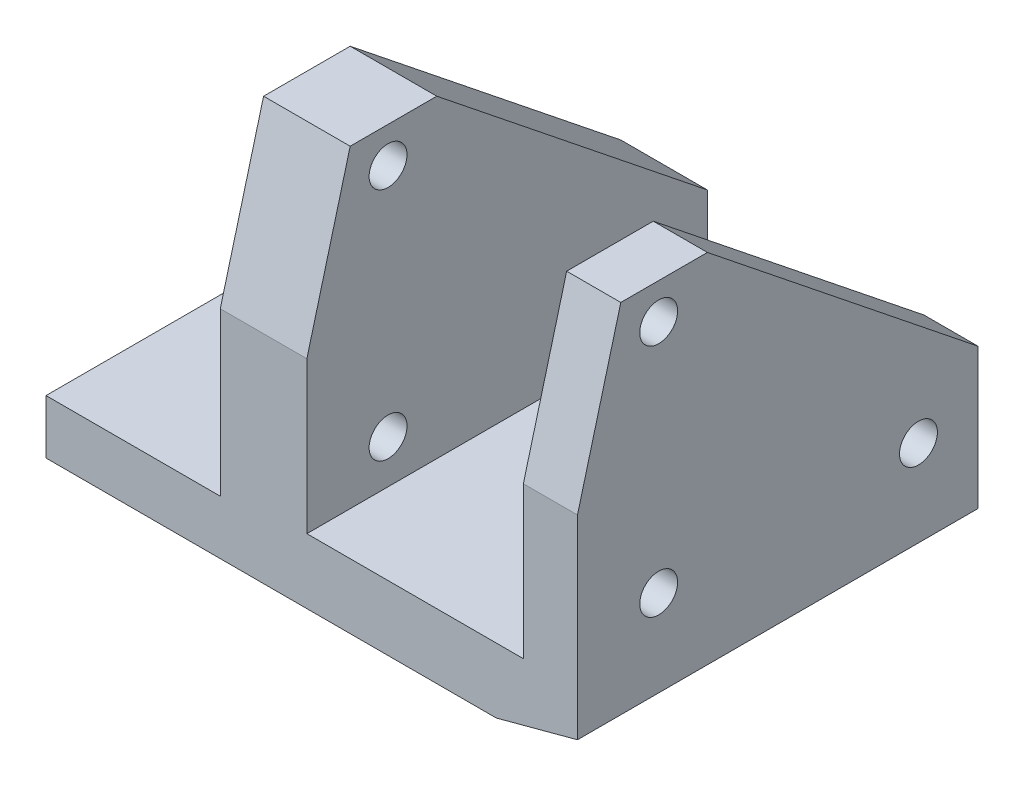
from build123d import *

# Parameters (mm, degrees)
SZKIC1_W                         = 25.6
SZKIC1_H                         = 10
DODANIE_WYCI_GNI_CIE1_DEPTH      = 5
SZKIC2_R                         = 1.75
WYTNIJ_WYCI_GNI_CIE1_DEPTH       = 5
SZKIC3_W                         = 25.6
SZKIC3_H                         = 5
DODANIE_WYCI_GNI_CIE2_DEPTH      = 5
SZKIC4_W                         = 25.6
SZKIC4_H                         = 5
DODANIE_WYCI_GNI_CIE3_DEPTH      = 17
SZKIC5_R                         = 1.75
WYTNIJ_WYCI_GNI_CIE2_DEPTH       = 20
SZKIC6_W                         = 2
SZKIC6_H                         = 15
WYTNIJ_WYCI_GNI_CIE3_DEPTH       = 28.346663416
DODANIE_WYCI_GNI_CIE4_DEPTH      = 0.5
DODANIE_WYCI_GNI_CIE4_DEPTH_BACK = 7.5
SZKIC8_R                         = 1.75
WYTNIJ_WYCI_GNI_CIE4_DEPTH       = 48.531147682
SZKIC9_W                         = 37
SZKIC9_H                         = 6
DODANIE_WYCI_GNI_CIE5_DEPTH      = 20.5
SZKIC10_W                        = 37
SZKIC10_H                        = 6
SZKIC10_R                        = 1.75
DODANIE_WYCI_GNI_CIE6_DEPTH      = 5
SZKIC11_W                        = 16.1
SZKIC11_H                        = 5
DODANIE_WYCI_GNI_CIE7_DEPTH      = 15
SFAZOWANIE2_SIZE                 = 7.5
SFAZOWANIE2_SIZE2                = 2.009618943


with BuildPart() as part:
    # Szkic1 → Dodanie-wyciągnięcie1 (new body)
    with BuildSketch(Plane.XY):
        Rectangle(SZKIC1_W, SZKIC1_H)
    extrude(amount=DODANIE_WYCI_GNI_CIE1_DEPTH)

    # Szkic2 → Wytnij-wyciągnięcie1 (cut)
    with BuildSketch(Plane.XY.offset(5)):
        with Locations((-6, 0)):
            Circle(SZKIC2_R)
        with Locations((6, 0)):
            Circle(SZKIC2_R)
    extrude(amount=-WYTNIJ_WYCI_GNI_CIE1_DEPTH, mode=Mode.SUBTRACT)

    # Szkic3 → Dodanie-wyciągnięcie2 (add)
    with BuildSketch(Plane(origin=(0, 5, 0), x_dir=(1, 0, 0), z_dir=(0, 1, 0))):
        with Locations((0, -2.5)):
            Rectangle(SZKIC3_W, SZKIC3_H)
    extrude(amount=DODANIE_WYCI_GNI_CIE2_DEPTH)

    # Szkic4 → Dodanie-wyciągnięcie3 (add)
    with BuildSketch(Plane(origin=(0, 0, 0), x_dir=(-1, 0, 0), z_dir=(0, 0, -1))):
        with Locations((0, 7.5)):
            Rectangle(SZKIC4_W, SZKIC4_H)
    extrude(amount=DODANIE_WYCI_GNI_CIE3_DEPTH)

    # Szkic5 → Wytnij-wyciągnięcie2 (cut)
    with BuildSketch(Plane(origin=(0, 10, 0), x_dir=(1, 0, 0), z_dir=(0, 1, 0))):
        with Locations(Location((-0.8, 12, 0), (0, 0, 180))):
            Circle(SZKIC5_R)
    extrude(amount=-WYTNIJ_WYCI_GNI_CIE2_DEPTH, mode=Mode.SUBTRACT)

    # Szkic6 → Wytnij-wyciągnięcie3 (cut, through all)
    with BuildSketch(Plane.XY.offset(5)):
        with Locations((11.8, 2.5)):
            Rectangle(SZKIC6_W, SZKIC6_H)
    extrude(amount=-WYTNIJ_WYCI_GNI_CIE3_DEPTH, mode=Mode.SUBTRACT)

    # Szkic7 → Dodanie-wyciągnięcie4 (add, two sides: drawn at the far end of the back side and taken through both)
    with BuildSketch(Plane(origin=(10.8, 0, 0), x_dir=(0, 0, -1), z_dir=(1, 0, 0)).offset(-DODANIE_WYCI_GNI_CIE4_DEPTH_BACK)):
        Polygon((-5, 10), (17, 10), (17, 20), (-8, 40), (-16, 40), (-20, 25), (-20, 5), (-5, 5), align=None)
    extrude(amount=DODANIE_WYCI_GNI_CIE4_DEPTH + DODANIE_WYCI_GNI_CIE4_DEPTH_BACK)

    # Szkic8 → Wytnij-wyciągnięcie4 (cut, through all)
    with BuildSketch(Plane.ZY.offset(-3.3)):
        with Locations((12.5, 15)):
            Circle(SZKIC8_R)
        with Locations((12.5, 36.7)):
            Circle(SZKIC8_R)
        with Locations((-11.5, 15)):
            Circle(SZKIC8_R)
    extrude(amount=-WYTNIJ_WYCI_GNI_CIE4_DEPTH, mode=Mode.SUBTRACT)

    # Szkic9 → Dodanie-wyciągnięcie5 (add)
    with BuildSketch(Plane(origin=(10.8, 0, 0), x_dir=(0, 0, -1), z_dir=(1, 0, 0))):
        with Locations((-1.5, 8)):
            Rectangle(SZKIC9_W, SZKIC9_H)
    extrude(amount=DODANIE_WYCI_GNI_CIE5_DEPTH)

    # Szkic10 → Dodanie-wyciągnięcie6 (add)
    # profile 1 of 2: a face of its own
    with BuildSketch(Plane(origin=(31.3, 0, 0), x_dir=(0, 0, -1), z_dir=(1, 0, 0))):
        with Locations((-1.5, 8)):
            Rectangle(SZKIC10_W, SZKIC10_H)
    # profile 2 of 2: a face of its own
    with BuildSketch(Plane(origin=(31.3, 0, 0), x_dir=(0, 0, -1), z_dir=(1, 0, 0))):
        Polygon((-8, 40), (-16, 40), (-20, 25), (-20, 11), (17, 11), (17, 20), align=None)
        with Locations(Location((-12.5, 15, 0), (0, 0, 180))):
            Circle(SZKIC10_R, mode=Mode.SUBTRACT)
        with Locations(Location((-12.5, 36.7, 0), (0, 0, 180))):
            Circle(SZKIC10_R, mode=Mode.SUBTRACT)
        with Locations(Location((11.5, 15, 0), (0, 0, 180))):
            Circle(SZKIC10_R, mode=Mode.SUBTRACT)
    extrude(amount=DODANIE_WYCI_GNI_CIE6_DEPTH)

    # Szkic11 → Dodanie-wyciągnięcie7 (add)
    with BuildSketch(Plane.XY.offset(5)):
        with Locations((-4.75, 7.5)):
            Rectangle(SZKIC11_W, SZKIC11_H)
    extrude(amount=DODANIE_WYCI_GNI_CIE7_DEPTH)

    # Sfazowanie2
    sfazowanie2_edges = [part.edges().sort_by_distance(p)[0] for p in [
        (36.3, 5, 1.5),
    ]]
    sfazowanie2_side = [part.faces().sort_by_distance(p)[0] for p in [
        (12.712207968, 5, 1.507036511),
    ]]
    chamfer(sfazowanie2_edges, length=SFAZOWANIE2_SIZE, length2=SFAZOWANIE2_SIZE2, reference=sfazowanie2_side[0])


solid = part.part
